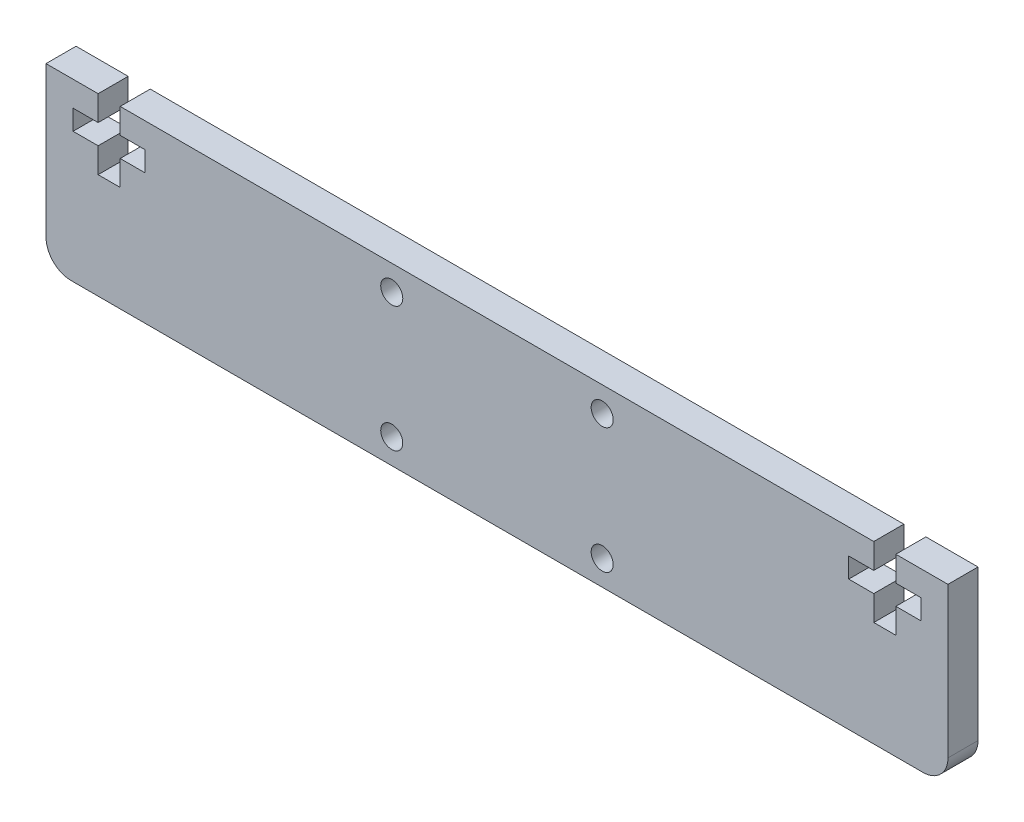
from build123d import *

# Parameters (mm, degrees)
SKETCH1_R           = 1.1
BOSS_EXTRUDE1_DEPTH = 3
FILLET1_R           = 2.5


with BuildPart() as part:
    # Sketch1 → Boss-Extrude1 (new body)
    with BuildSketch(Plane.XY):
        Polygon((-45, -8.75), (45, -8.75), (45, 8.75), (39.8, 8.75), (39.8, 6.25), (42.3, 6.25), (42.3, 4.25), (39.8, 4.25), (39.8, 1.75), (37.6, 1.75), (37.6, 4.25), (35.1, 4.25), (35.1, 6.25), (37.6, 6.25), (37.6, 8.75), (-37.6, 8.75), (-37.6, 6.25), (-35.1, 6.25), (-35.1, 4.25), (-37.6, 4.25), (-37.6, 1.75), (-39.8, 1.75), (-39.8, 4.25), (-42.3, 4.25), (-42.3, 6.25), (-39.8, 6.25), (-39.8, 8.75), (-45, 8.75), align=None)
        with Locations((-10.5, 6.25)):
            Circle(SKETCH1_R, mode=Mode.SUBTRACT)
        with Locations(Location((-10.5, -6.25, 0), (0, 0, 180))):
            Circle(SKETCH1_R, mode=Mode.SUBTRACT)
        with Locations((10.5, -6.25)):
            Circle(SKETCH1_R, mode=Mode.SUBTRACT)
        with Locations(Location((10.5, 6.25, 0), (0, 0, 180))):
            Circle(SKETCH1_R, mode=Mode.SUBTRACT)
    extrude(amount=BOSS_EXTRUDE1_DEPTH)

    # Fillet1
    fillet1_edges = [part.edges().sort_by_distance(p)[0] for p in [
        (45, -8.75, 1.5),
        (-45, -8.75, 1.5),
    ]]
    fillet(fillet1_edges, radius=FILLET1_R)


solid = part.part
